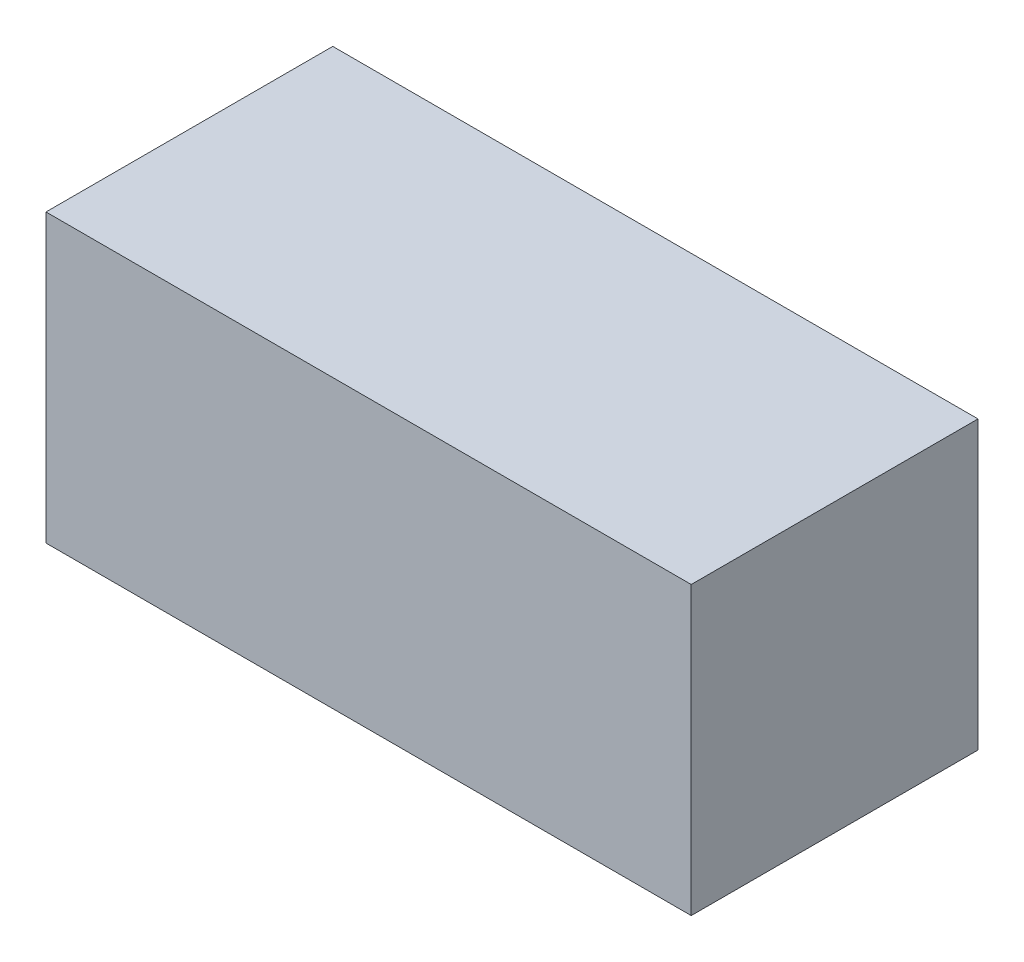
from build123d import *

# Parameters (mm, degrees)
SKETCH1_W           = 45
SKETCH1_H           = 20
BOSS_EXTRUDE1_DEPTH = 20


with BuildPart() as part:
    # Sketch1 → Boss-Extrude1 (new body)
    with BuildSketch(Plane.XY):
        Rectangle(SKETCH1_W, SKETCH1_H)
    extrude(amount=BOSS_EXTRUDE1_DEPTH)


solid = part.part
